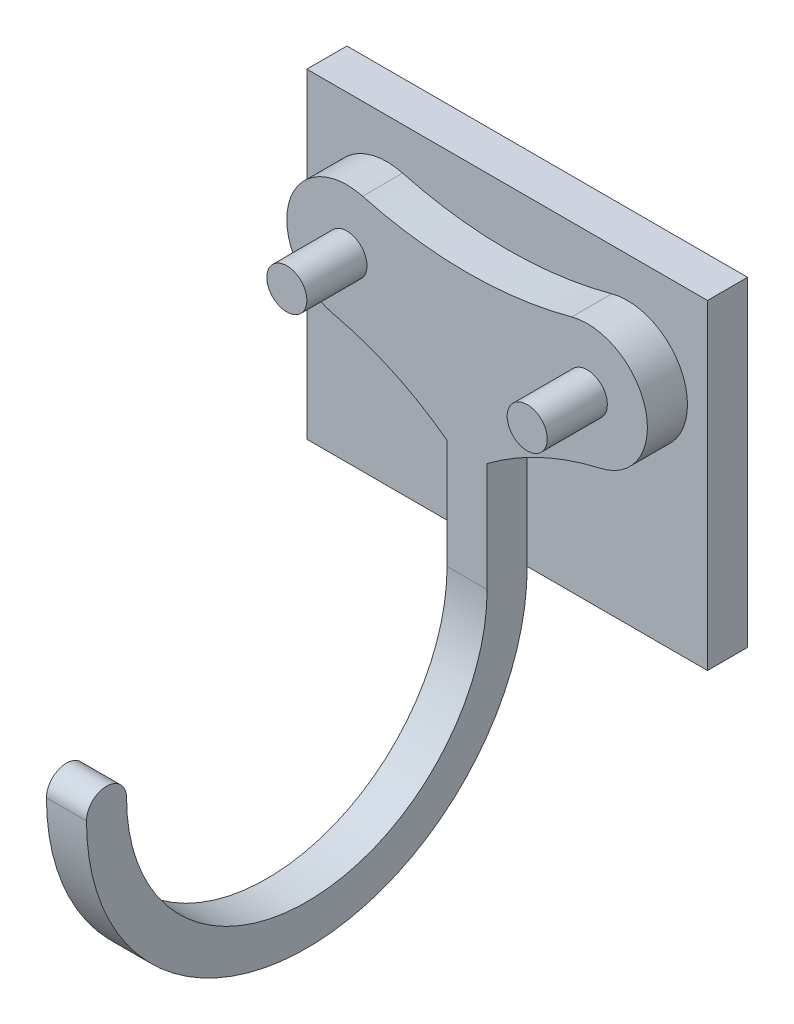
from build123d import *

# Parameters (mm, degrees)
BOSS_EXTRUDE1_DEPTH = 2
SKETCH1_4_R         = 1
BOSS_EXTRUDE2_DEPTH = 4
SKETCH1_6_R         = 1
BOSS_EXTRUDE3_DEPTH = 7
BOSS_EXTRUDE4_DEPTH = 2


with BuildPart() as part:
    # Sketch1 → Boss-Extrude1 (new body)
    with BuildSketch(Plane.XY):
        with BuildLine():
            Line((-10, 8), (-10, -8))
            Line((-10, -8), (-1, -8))
            Line((-1, -8), (-1, -2.549928775))
            ThreePointArc((-1, -2.549928775), (-3.695211651, -0.939284269), (-6.666666667, 0.075011871))
            ThreePointArc((-6.666666667, 0.075011871), (-8.911132412, 3.724781401), (-5.217391304, 5.896122171))
            ThreePointArc((-5.217391304, 5.896122171), (0, 5.203603311), (5.217391304, 5.896122171))
            ThreePointArc((5.217391304, 5.896122171), (8.911132412, 3.724781401), (6.666666667, 0.075011871))
            ThreePointArc((6.666666667, 0.075011871), (3.695211651, -0.939284269), (1, -2.549928775))
            Line((1, -2.549928775), (1, -8))
            Line((1, -8), (10, -8))
            Line((10, -8), (10, 8))
            Line((10, 8), (-10, 8))
        make_face()
    extrude(amount=BOSS_EXTRUDE1_DEPTH)

    # Sketch1<4> → Boss-Extrude2 (add)
    with BuildSketch(Plane.XY):
        with BuildLine():
            Line((-1, -2.549928775), (-1, -8))
            Line((-1, -8), (1, -8))
            Line((1, -8), (1, -2.549928775))
            ThreePointArc((1, -2.549928775), (3.695211651, -0.939284269), (6.666666667, 0.075011871))
            ThreePointArc((6.666666667, 0.075011871), (8.911132412, 3.724781401), (5.217391304, 5.896122171))
            ThreePointArc((5.217391304, 5.896122171), (0, 5.203603311), (-5.217391304, 5.896122171))
            ThreePointArc((-5.217391304, 5.896122171), (-8.911132412, 3.724781401), (-6.666666667, 0.075011871))
            ThreePointArc((-6.666666667, 0.075011871), (-3.695211651, -0.939284269), (-1, -2.549928775))
        make_face()
        with Locations((-6, 3)):
            Circle(SKETCH1_4_R, mode=Mode.SUBTRACT)
        with Locations((6, 3)):
            Circle(SKETCH1_4_R, mode=Mode.SUBTRACT)
    extrude(amount=BOSS_EXTRUDE2_DEPTH)

    # Sketch1<6> → Boss-Extrude3 (add)
    with BuildSketch(Plane.XY):
        with Locations((-6, 3)):
            Circle(SKETCH1_6_R)
        with Locations((6, 3)):
            Circle(SKETCH1_6_R)
    extrude(amount=BOSS_EXTRUDE3_DEPTH)

    # Sketch2 → Boss-Extrude4 (add)
    with BuildSketch(Plane(origin=(1, 0, 0), x_dir=(0, 0, -1), z_dir=(1, 0, 0))):
        with BuildLine():
            Line((-2, -8), (-4, -8))
            ThreePointArc((-4, -8), (-13, -17), (-22, -8))
            ThreePointArc((-22, -8), (-23, -7), (-24, -8))
            ThreePointArc((-24, -8), (-13, -19), (-2, -8))
        make_face()
    extrude(amount=-BOSS_EXTRUDE4_DEPTH)


solid = part.part
